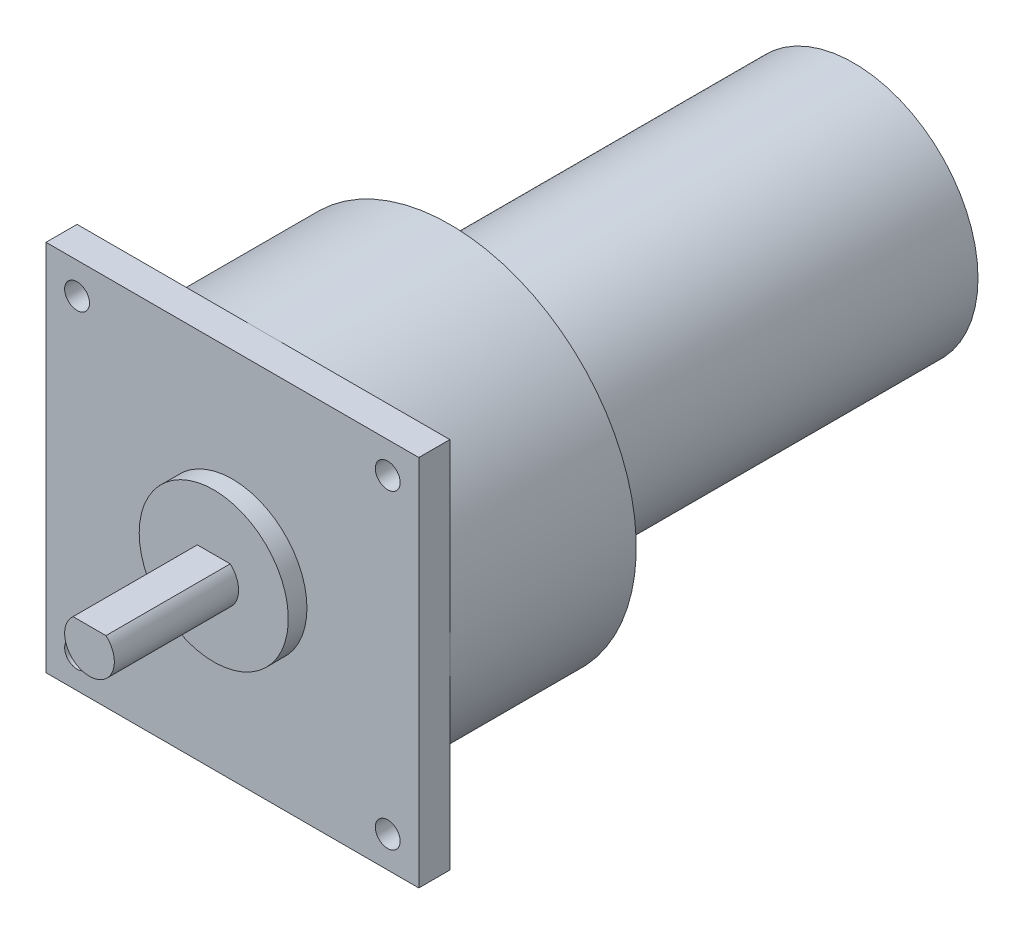
from build123d import *

# Parameters (mm, degrees)
SKETCH1_W           = 60
SKETCH1_H           = 60
BOSS_EXTRUDE1_DEPTH = 5
SKETCH2_R           = 2
HOLE_DEPTH          = 5
SKETCH3_R           = 12
BOSS_EXTRUDE2_DEPTH = 8
SHAFT_DEPTH         = 20
SKETCH5_R           = 30
GEAR_DEPTH          = 30
SKETCH6_R           = 20
MOTOR_DEPTH         = 65


with BuildPart() as part:
    # Sketch1 → Boss-Extrude1 (new body)
    with BuildSketch(Plane.XY):
        Rectangle(SKETCH1_W, SKETCH1_H)
    extrude(amount=BOSS_EXTRUDE1_DEPTH)

    # Sketch2 → hole (cut)
    with BuildSketch(Plane(origin=(0, 0, 0), x_dir=(-1, 0, 0), z_dir=(0, 0, -1))):
        with Locations((-25, 25)):
            Circle(SKETCH2_R)
        with Locations((25, 25)):
            Circle(SKETCH2_R)
        with Locations((25, -25)):
            Circle(SKETCH2_R)
        with Locations((-25, -25)):
            Circle(SKETCH2_R)
    extrude(amount=-HOLE_DEPTH, mode=Mode.SUBTRACT)

    # Sketch3 → Boss-Extrude2 (add)
    with BuildSketch(Plane(origin=(0, 0, 0), x_dir=(-1, 0, 0), z_dir=(0, 0, -1))):
        Circle(SKETCH3_R)
    extrude(amount=-BOSS_EXTRUDE2_DEPTH)

    # Sketch4 → shaft (add)
    with BuildSketch(Plane.XY.offset(8)):
        with BuildLine():
            Line((-2.645751311, 3), (2.645751311, 3))
            ThreePointArc((2.645751311, 3), (0, -4), (-2.645751311, 3))
        make_face()
    extrude(amount=SHAFT_DEPTH)

    # Sketch5 → gear (add)
    with BuildSketch(Plane(origin=(0, 0, 0), x_dir=(-1, 0, 0), z_dir=(0, 0, -1))):
        Circle(SKETCH5_R)
    extrude(amount=GEAR_DEPTH)

    # Sketch6 → motor (add)
    with BuildSketch(Plane(origin=(0, 0, -30), x_dir=(-1, 0, 0), z_dir=(0, 0, -1))):
        Circle(SKETCH6_R)
    extrude(amount=MOTOR_DEPTH)


solid = part.part
